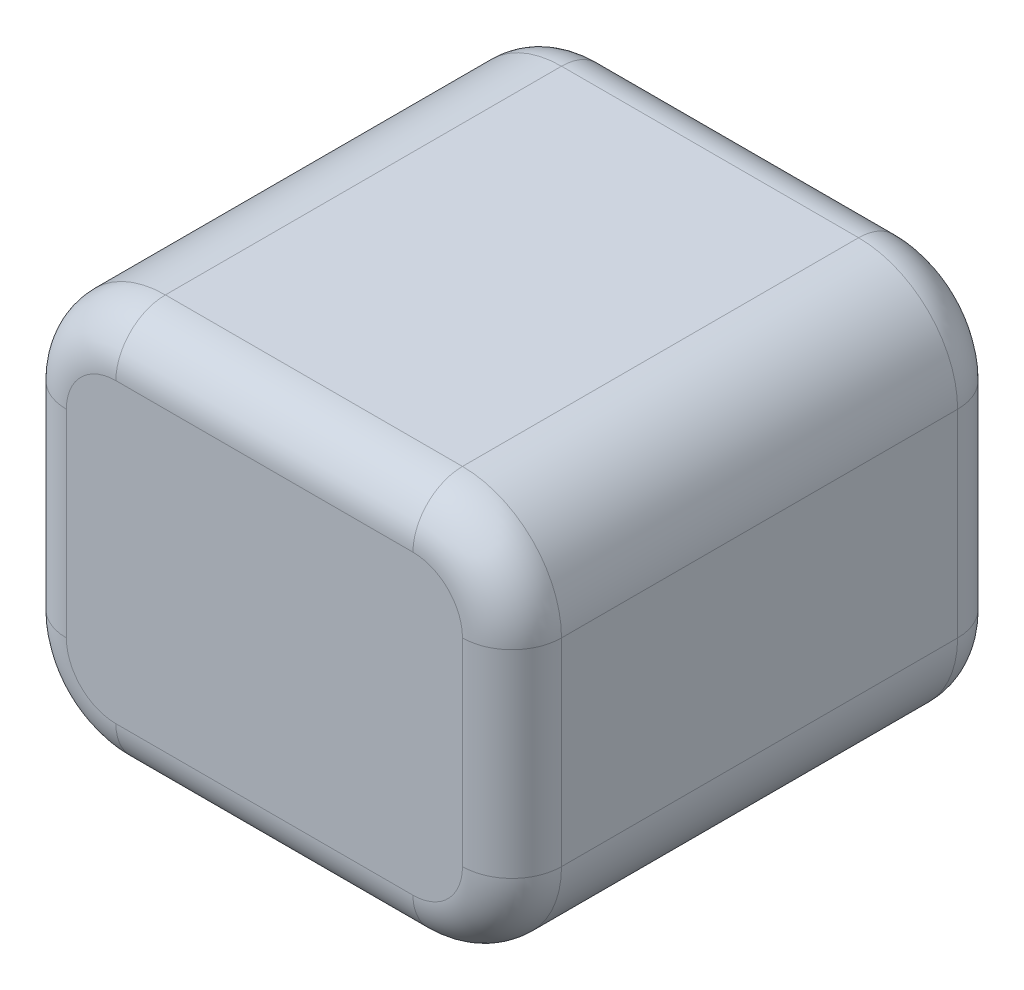
from build123d import *

# Parameters (mm, degrees)
SKETCH_1_W          = 100
SKETCH_1_H          = 80
EXTRUDE_1_DEPTH     = 100
FILLET_1_R          = 20
FILLET_2_R          = 10
CUT_EXTRUDE_1_DEPTH = 5


with BuildPart() as part:
    # Эскиз1 → Бобышка-Вытянуть1 (new body)
    with BuildSketch(Plane.XY):
        with Locations((50, 40)):
            Rectangle(SKETCH_1_W, SKETCH_1_H)
    extrude(amount=EXTRUDE_1_DEPTH)

    # Скругление1
    fillet_1_edges = [part.edges().sort_by_distance(p)[0] for p in [
        (100, 0, 50),
        (0, 0, 50),
        (0, 80, 50),
        (100, 80, 50),
    ]]
    fillet(fillet_1_edges, radius=FILLET_1_R)

    # Скругление2
    fillet_2_edges = [part.edges().sort_by_distance(p)[0] for p in [
        (50, 80, 0),
        (50, 80, 100),
        (100, 40, 0),
        (50, 0, 0),
        (0, 40, 0),
        (5.857864376, 5.857864376, 0),
        (5.857864376, 74.142135624, 0),
        (94.142135624, 5.857864376, 0),
        (94.142135624, 74.142135624, 0),
        (100, 40, 100),
        (0, 40, 100),
        (50, 0, 100),
        (5.857864376, 5.857864376, 100),
        (5.857864376, 74.142135624, 100),
        (94.142135624, 5.857864376, 100),
        (94.142135624, 74.142135624, 100),
    ]]
    fillet(fillet_2_edges, radius=FILLET_2_R)

    # Эскиз2 → Вырез-Вытянуть1 (cut)
    with BuildSketch(Plane.XZ):
        with BuildLine():
            Line((20, 10), (80, 10))
            add(Edge.make_bspline(
                [(80, 10), (80, 80), (50, 80), (20, 80), (20, 10)],
                knots=[4.71238898, 4.71238898, 4.71238898, 6.283185307, 6.283185307, 7.853981634, 7.853981634, 7.853981634], degree=2, weights=[1, 0.707106781, 1, 0.707106781, 1]))
        make_face()
    extrude(amount=-CUT_EXTRUDE_1_DEPTH, mode=Mode.SUBTRACT)


solid = part.part
